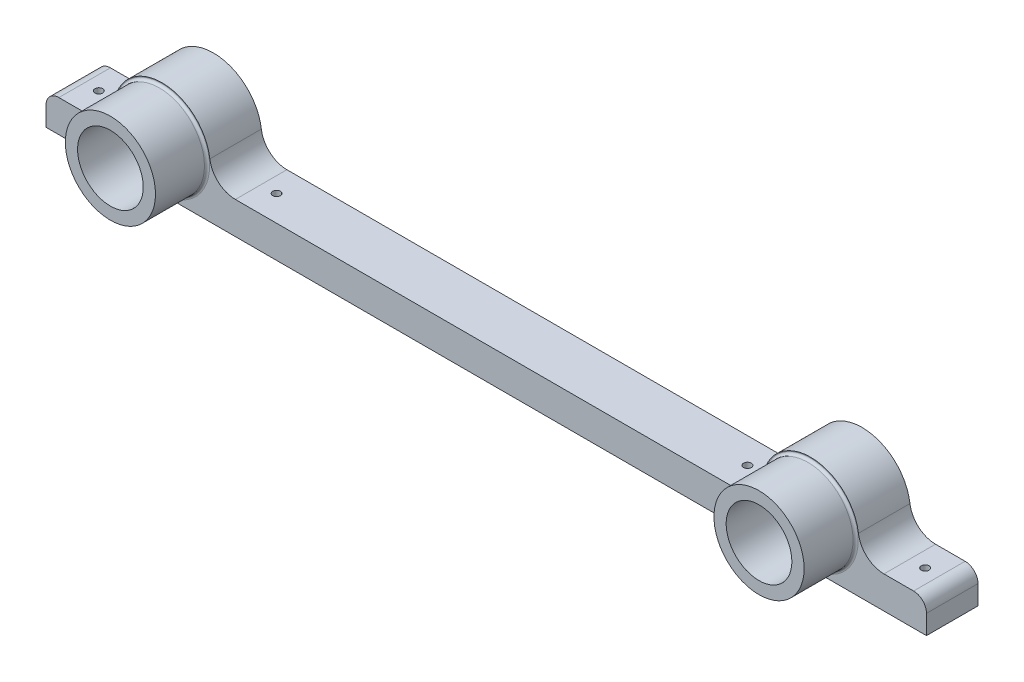
from build123d import *

# Parameters (mm, degrees)
SKETCH1_R           = 0.635
BOSS_EXTRUDE1_DEPTH = 5.08
SKETCH2_R           = 4.445
SKETCH2_R_2         = 0.635
BOSS_EXTRUDE2_DEPTH = 5.08
SKETCH3_R           = 3.2385
CUT_EXTRUDE1_DEPTH  = 6.35
FILLET1_R           = 0.254
FILLET2_R           = 2.54
FILLET3_R           = 1.27
SKETCH5_R           = 0.381
CUT_EXTRUDE3_DEPTH  = 83.603101422


with BuildPart() as part:
    # Sketch1 → Boss-Extrude1 (new body)
    with BuildSketch(Plane.XY):
        with BuildLine():
            Line((0, 0), (76.64958, 0))
            Line((76.64958, 0), (81.72958, 0))
            Line((81.72958, 0), (81.72958, 3.175))
            Line((81.72958, 3.175), (76.64958, 3.175))
            Line((76.64958, 3.175), (75.06208, 3.175))
            Line((75.06208, 3.175), (75.06208, 4.7625))
            ThreePointArc((75.06208, 4.7625), (70.29958, 9.525), (65.53708, 4.7625))
            Line((65.53708, 4.7625), (65.53708, 3.175))
            Line((65.53708, 3.175), (11.1125, 3.175))
            Line((11.1125, 3.175), (11.1125, 4.7625))
            ThreePointArc((11.1125, 4.7625), (6.35, 9.525), (1.5875, 4.7625))
            Line((1.5875, 4.7625), (1.5875, 3.175))
            Line((1.5875, 3.175), (0, 3.175))
            Line((0, 3.175), (-5.08, 3.175))
            Line((-5.08, 3.175), (-5.08, 0))
            Line((-5.08, 0), (0, 0))
        make_face()
        with Locations((6.35, 4.7625)):
            Circle(SKETCH1_R, mode=Mode.SUBTRACT)
        with Locations((70.29958, 4.7625)):
            Circle(SKETCH1_R, mode=Mode.SUBTRACT)
    extrude(amount=BOSS_EXTRUDE1_DEPTH)

    # Sketch2 → Boss-Extrude2 (add)
    # profile 1 of 2: a face of its own
    with BuildSketch(Plane.XY.offset(5.08)):
        with Locations((6.35, 4.7625)):
            Circle(SKETCH2_R)
        with Locations((6.35, 4.7625)):
            Circle(SKETCH2_R_2, mode=Mode.SUBTRACT)
    # profile 2 of 2: a face of its own
    with BuildSketch(Plane.XY.offset(5.08)):
        with Locations((70.29958, 4.7625)):
            Circle(SKETCH2_R)
        with Locations((70.29958, 4.7625)):
            Circle(SKETCH2_R_2, mode=Mode.SUBTRACT)
    extrude(amount=BOSS_EXTRUDE2_DEPTH)

    # Sketch3 → Cut-Extrude1 (cut)
    with BuildSketch(Plane.XY.offset(10.16)):
        with Locations((6.35, 4.7625)):
            Circle(SKETCH3_R)
        with Locations((70.29958, 4.7625)):
            Circle(SKETCH3_R)
    extrude(amount=-CUT_EXTRUDE1_DEPTH, mode=Mode.SUBTRACT)

    # Fillet1
    fillet1_edges = [part.edges().sort_by_distance(p)[0] for p in [
        (1.905, 4.7625, 5.08),
        (65.85458, 4.7625, 5.08),
    ]]
    fillet(fillet1_edges, radius=FILLET1_R)

    # Fillet2
    fillet2_edges = [part.edges().sort_by_distance(p)[0] for p in [
        (75.06208, 3.175, 2.54),
        (11.1125, 3.175, 2.54),
        (65.53708, 3.175, 2.54),
        (1.5875, 3.175, 2.54),
    ]]
    fillet(fillet2_edges, radius=FILLET2_R)

    # Fillet3
    fillet3_edges = [part.edges().sort_by_distance(p)[0] for p in [
        (-5.08, 3.175, 2.54),
        (81.72958, 3.175, 2.54),
    ]]
    fillet(fillet3_edges, radius=FILLET3_R)

    # Sketch5 → Cut-Extrude3 (cut, through all)
    with BuildSketch(Plane(origin=(0, 3.175, 0), x_dir=(1, 0, 0), z_dir=(0, 1, 0))):
        with Locations(Location((-2.413, -2.54, 0), (0, 0, 180))):
            Circle(SKETCH5_R)
        with Locations(Location((79.06258, -2.54, 0), (0, 0, 180))):
            Circle(SKETCH5_R)
        with Locations(Location((61.53658, -2.54, 0), (0, 0, 180))):
            Circle(SKETCH5_R)
        with Locations(Location((15.113, -2.54, 0), (0, 0, 180))):
            Circle(SKETCH5_R)
    extrude(amount=-CUT_EXTRUDE3_DEPTH, mode=Mode.SUBTRACT)


solid = part.part
